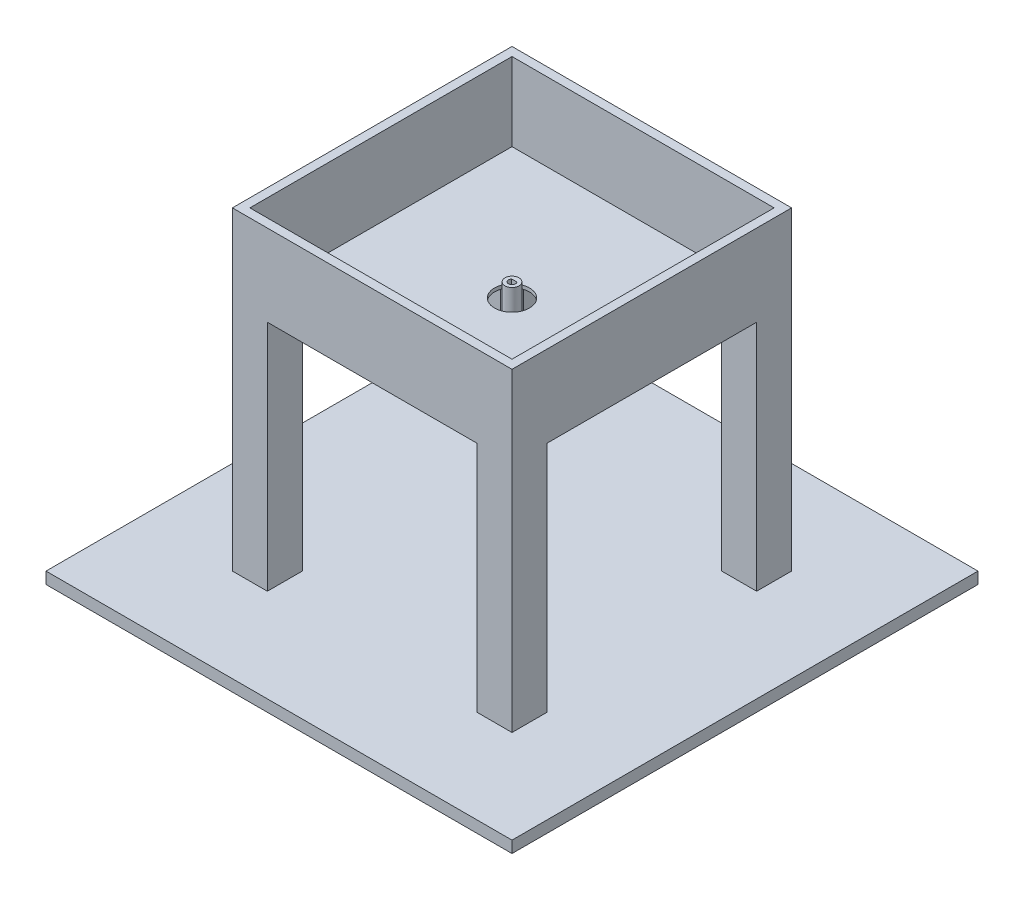
from build123d import *

# Parameters (mm, degrees)
SKETCH_1_W          = 112.5
SKETCH_1_H          = 112.5
EXTRUDE_1_DEPTH     = 1.5
SKETCH_2_R          = 3
EXTRUDE_2_DEPTH     = 6
CUT_EXTRUDE_1_DEPTH = 6
SKETCH_4_W          = 120
SKETCH_4_H          = 120
SKETCH_4_W_2        = 112.5
SKETCH_4_H_2        = 112.5
EXTRUDE_3_DEPTH     = 35
SKETCH_5_W          = 15
SKETCH_5_H          = 15
EXTRUDE_4_DEPTH     = 100
SKETCH_6_W          = 200
SKETCH_6_H          = 200
EXTRUDE_5_DEPTH     = 5
CUT_EXTRUDE_3_REACH = 179.037
SKETCH_7_R          = 7.5
SKETCH_8_R          = 3
EXTRUDE_6_DEPTH     = 20
SKETCH_9_W          = 30
SKETCH_9_H          = 30
EXTRUDE_7_DEPTH     = 2
EXTRUDE_8_REACH     = 167.778
SKETCH_10_W         = 5
SKETCH_10_H         = 5


with BuildPart() as part:
    # 草图1 → 凸台-拉伸1 (new body)
    with BuildSketch(Plane(origin=(0, 0, 0), x_dir=(1, 0, 0), z_dir=(0, 1, 0))):
        Rectangle(SKETCH_1_W, SKETCH_1_H)
    extrude(amount=EXTRUDE_1_DEPTH)

    # 草图2 → 凸台-拉伸2 (add)
    with BuildSketch(Plane(origin=(0, 1.5, 0), x_dir=(1, 0, 0), z_dir=(0, 1, 0))):
        with Locations(Location((0, 0, 0), (0, 0, 270))):
            Circle(SKETCH_2_R)
    extrude(amount=EXTRUDE_2_DEPTH)

    # 草图3 → 切除-拉伸1 (cut)
    with BuildSketch(Plane(origin=(0, 7.5, 0), x_dir=(1, 0, 0), z_dir=(0, 1, 0))):
        with BuildLine():
            Line((-1.118033989, 1), (1.118033989, 1))
            ThreePointArc((1.118033989, 1), (0, -1.5), (-1.118033989, 1))
        make_face()
    extrude(amount=-CUT_EXTRUDE_1_DEPTH, mode=Mode.SUBTRACT)

    # 草图4 → 凸台-拉伸3 (add)
    with BuildSketch(Plane(origin=(0, 0, 0), x_dir=(1, 0, 0), z_dir=(0, 1, 0))):
        Rectangle(SKETCH_4_W, SKETCH_4_H)
        Rectangle(SKETCH_4_W_2, SKETCH_4_H_2, mode=Mode.SUBTRACT)
    extrude(amount=EXTRUDE_3_DEPTH)

    # 草图5 → 凸台-拉伸4 (add)
    with BuildSketch(Plane(origin=(0, 0, 0), x_dir=(1, 0, 0), z_dir=(0, 1, 0))):
        with Locations((-52.5, -52.5)):
            Rectangle(SKETCH_5_W, SKETCH_5_H)
        with Locations((52.5, -52.5)):
            Rectangle(SKETCH_5_W, SKETCH_5_H)
        with Locations((52.5, 52.5)):
            Rectangle(SKETCH_5_W, SKETCH_5_H)
        with Locations((-52.5, 52.5)):
            Rectangle(SKETCH_5_W, SKETCH_5_H)
    extrude(amount=-EXTRUDE_4_DEPTH)

    # 草图6 → 凸台-拉伸5 (add)
    with BuildSketch(Plane(origin=(0, -100, 0), x_dir=(-1, 0, 0), z_dir=(0, -1, 0))):
        Rectangle(SKETCH_6_W, SKETCH_6_H)
    extrude(amount=EXTRUDE_5_DEPTH)

    # 草图7 → 切除-拉伸3 (cut, up to next)
    with BuildSketch(Plane(origin=(0, 1.5, 0), x_dir=(1, 0, 0), z_dir=(0, 1, 0)), mode=Mode.PRIVATE) as cut_extrude_3_sk1:
        with Locations(Location((0, 0, 0), (0, 0, 270))):
            Circle(SKETCH_7_R)
    cut_extrude_3_tool1 = extrude(cut_extrude_3_sk1.sketch, amount=-CUT_EXTRUDE_3_REACH, mode=Mode.PRIVATE) & part.part
    add(cut_extrude_3_tool1.solids().sort_by_distance((0, 1.5, 0))[0], mode=Mode.SUBTRACT)


with BuildPart() as cut_extrude_3_piece_1:
    # of the separate pieces the step leaves, piece 1, a body of its own (cut_extrude_3_pieces)
    add(part.part.solids().sort_by_distance((100, -100, -100))[0])

    # 草图10 → 凸台-拉伸8 (add, up to next)
    with BuildSketch(Plane(origin=(0, -18.5, 0), x_dir=(1, 0, 0), z_dir=(0, 1, 0)), mode=Mode.PRIVATE) as extrude_8_sk1:
        with Locations((-12.5, 12.5)):
            Rectangle(SKETCH_10_W, SKETCH_10_H)
    extrude_8_tool1 = extrude(extrude_8_sk1.sketch, amount=EXTRUDE_8_REACH, mode=Mode.PRIVATE) - cut_extrude_3_piece_1.part
    # 草图10 → 凸台-拉伸8 (add, up to next)
    with BuildSketch(Plane(origin=(0, -18.5, 0), x_dir=(1, 0, 0), z_dir=(0, 1, 0)), mode=Mode.PRIVATE) as extrude_8_sk2:
        with Locations((12.5, -12.5)):
            Rectangle(SKETCH_10_W, SKETCH_10_H)
    extrude_8_tool2 = extrude(extrude_8_sk2.sketch, amount=EXTRUDE_8_REACH, mode=Mode.PRIVATE) - cut_extrude_3_piece_1.part
    # 草图10 → 凸台-拉伸8 (add, up to next)
    with BuildSketch(Plane(origin=(0, -18.5, 0), x_dir=(1, 0, 0), z_dir=(0, 1, 0)), mode=Mode.PRIVATE) as extrude_8_sk3:
        with Locations((12.5, 12.5)):
            Rectangle(SKETCH_10_W, SKETCH_10_H)
    extrude_8_tool3 = extrude(extrude_8_sk3.sketch, amount=EXTRUDE_8_REACH, mode=Mode.PRIVATE) - cut_extrude_3_piece_1.part
    # 草图10 → 凸台-拉伸8 (add, up to next)
    with BuildSketch(Plane(origin=(0, -18.5, 0), x_dir=(1, 0, 0), z_dir=(0, 1, 0)), mode=Mode.PRIVATE) as extrude_8_sk4:
        with Locations((-12.5, -12.5)):
            Rectangle(SKETCH_10_W, SKETCH_10_H)
    extrude_8_tool4 = extrude(extrude_8_sk4.sketch, amount=EXTRUDE_8_REACH, mode=Mode.PRIVATE) - cut_extrude_3_piece_1.part


with BuildPart() as cut_extrude_3_piece_2:
    # of the separate pieces the step leaves, piece 2, a body of its own (cut_extrude_3_pieces)
    add(part.part.solids().sort_by_distance((0, 1.5, 3))[0])

    # 草图8 → 凸台-拉伸6 (add)
    with BuildSketch(Plane(origin=(0, 1.5, 0), x_dir=(-1, 0, 0), z_dir=(0, -1, 0))):
        with Locations(Location((0, 0, 0), (0, 0, 90))):
            Circle(SKETCH_8_R)
    extrude(amount=EXTRUDE_6_DEPTH)


with BuildPart() as body_3:
    # 草图9 → 凸台-拉伸7 (new body)
    with BuildSketch(Plane(origin=(0, -18.5, 0), x_dir=(-1, 0, 0), z_dir=(0, -1, 0))):
        Rectangle(SKETCH_9_W, SKETCH_9_H)
    extrude(amount=EXTRUDE_7_DEPTH)


with BuildPart() as cut_extrude_3_piece_1_1:
    add(cut_extrude_3_piece_1.part)

    add(body_3.part)  # 凸台-拉伸8 merges body 3
    add(extrude_8_tool1.solids().sort_by_distance((-12.5, -18.5, -12.5))[0])
    add(extrude_8_tool2.solids().sort_by_distance((12.5, -18.5, 12.5))[0])
    add(extrude_8_tool3.solids().sort_by_distance((12.5, -18.5, -12.5))[0])
    add(extrude_8_tool4.solids().sort_by_distance((-12.5, -18.5, 12.5))[0])


solid = Compound([cut_extrude_3_piece_2.part, cut_extrude_3_piece_1_1.part])
